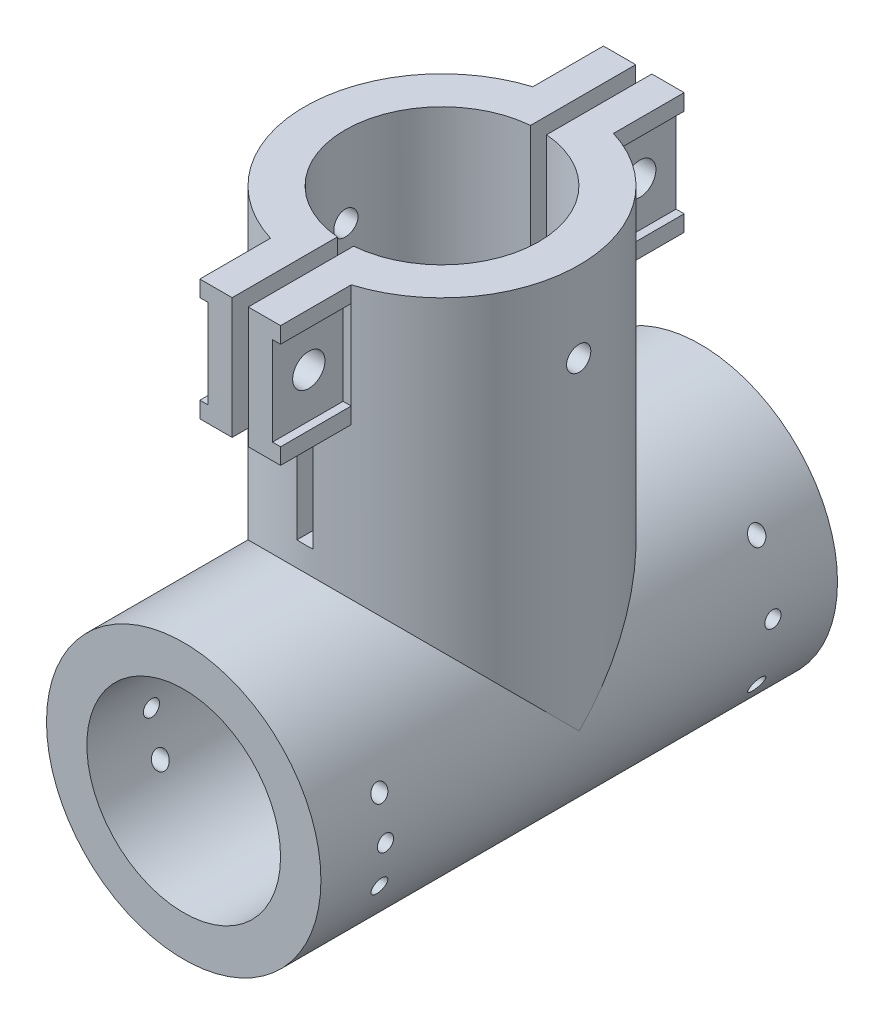
from build123d import *

# Parameters (mm, degrees)
SKETCH1_R             = 17
SKETCH1_R_2           = 12
BOSS_EXTRUDE1_DEPTH   = 64
SKETCH2_R             = 17
SKETCH2_R_2           = 12
BOSS_EXTRUDE2_DEPTH   = 50
SKETCH3_R             = 12
CUT_EXTRUDE1_DEPTH    = 98.406806537
SKETCH4_W             = 10
SKETCH4_H             = 15
BOSS_EXTRUDE3_DEPTH   = 25
SKETCH5_W             = 2
SKETCH5_H             = 30
CUT_EXTRUDE2_DEPTH    = 50
CUT_EXTRUDE3_START    = -50
SKETCH6_R             = 12
CUT_EXTRUDE3_DEPTH    = 50
SKETCH7_W             = 8.751923191
SKETCH7_H             = 11
KES_EKSTR_ZYON4_DEPTH = 1
SKETCH8_R             = 2
CUT_EXTRUDE5_DEPTH    = 87.59610122
SKETCH9_R             = 1
SKETCH9_R_2           = 1.5
CUT_EXTRUDE6_DEPTH    = 91.630484642
CUT_EXTRUDE7_DEPTH    = 1


with BuildPart() as part:
    # Sketch1 → Boss-Extrude1 (new body)
    with BuildSketch(Plane.XY):
        with Locations((-32.297070802, 4.423200443)):
            Circle(SKETCH1_R)
        with Locations((-32.297070802, 4.423200443)):
            Circle(SKETCH1_R_2, mode=Mode.SUBTRACT)
    extrude(amount=BOSS_EXTRUDE1_DEPTH)

    # Sketch2 → Boss-Extrude2 (add)
    with BuildSketch(Plane(origin=(0, 4.423200443, 0), x_dir=(1, 0, 0), z_dir=(0, 1, 0))):
        with Locations((-32.297070802, -32)):
            Circle(SKETCH2_R)
        with Locations((-32.297070802, -32)):
            Circle(SKETCH2_R_2, mode=Mode.SUBTRACT)
    extrude(amount=BOSS_EXTRUDE2_DEPTH)

    # Sketch3 → Cut-Extrude1 (cut, through all)
    with BuildSketch(Plane.XY.offset(64)):
        with Locations((-32.297070802, 4.423200443)):
            Circle(SKETCH3_R)
    extrude(amount=-CUT_EXTRUDE1_DEPTH, mode=Mode.SUBTRACT)

    # Sketch4 → Boss-Extrude3 (add, symmetric)
    with BuildSketch(Plane(origin=(0, 0, 32), x_dir=(-1, 0, 0), z_dir=(0, 0, -1))):
        with Locations((32.297070802, 46.923200443)):
            Rectangle(SKETCH4_W, SKETCH4_H)
    extrude(amount=BOSS_EXTRUDE3_DEPTH, both=True)

    # Sketch5 → Cut-Extrude2 (cut)
    with BuildSketch(Plane.XY.offset(57)):
        with Locations((-32.297070802, 39.423200443)):
            Rectangle(SKETCH5_W, SKETCH5_H)
    extrude(amount=-CUT_EXTRUDE2_DEPTH, mode=Mode.SUBTRACT)

    # Sketch6 → Cut-Extrude3 (cut)
    with BuildSketch(Plane(origin=(0, 54.423200443, 0), x_dir=(1, 0, 0), z_dir=(0, 1, 0)).offset(CUT_EXTRUDE3_START)):
        with Locations((-32.297070802, -32)):
            Circle(SKETCH6_R)
    extrude(amount=CUT_EXTRUDE3_DEPTH, mode=Mode.SUBTRACT)

    # Sketch7 → Kes-Ekstrüzyon4 (cut)
    with BuildSketch(Plane(origin=(-27.297070802, 0, 0), x_dir=(0, 0, -1), z_dir=(1, 0, 0))):
        with Locations((-52.624038404, 46.923200443)):
            Rectangle(SKETCH7_W, SKETCH7_H)
        with Locations((-11.375961596, 46.923200443)):
            Rectangle(SKETCH7_W, SKETCH7_H)
    extrude(amount=-KES_EKSTR_ZYON4_DEPTH, mode=Mode.SUBTRACT)

    # Sketch8 → Cut-Extrude5 (cut, through all)
    with BuildSketch(Plane(origin=(-28.297070802, 0, 0), x_dir=(0, 0, -1), z_dir=(1, 0, 0))):
        with Locations((-52.5, 46.923200443)):
            Circle(SKETCH8_R)
        with Locations((-11.5, 46.923200443)):
            Circle(SKETCH8_R)
    extrude(amount=-CUT_EXTRUDE5_DEPTH, mode=Mode.SUBTRACT)

    # Sketch9 → Cut-Extrude6 (cut, through all)
    with BuildSketch(Plane(origin=(-15.297070802, 0, 0), x_dir=(0, 0, -1), z_dir=(1, 0, 0))):
        with Locations((-56, 4.423200443)):
            Circle(SKETCH9_R)
        with Locations((-56, 9.423200443)):
            Circle(SKETCH9_R)
        with Locations((-56, -0.576799557)):
            Circle(SKETCH9_R)
        with Locations((-8, 4.423200443)):
            Circle(SKETCH9_R)
        with Locations((-8, 12.423200443)):
            Circle(SKETCH9_R)
        with Locations((-8, -3.576799557)):
            Circle(SKETCH9_R)
        with Locations((-32, 44.423200443)):
            Circle(SKETCH9_R_2)
    extrude(amount=-CUT_EXTRUDE6_DEPTH, mode=Mode.SUBTRACT)

    # Sketch10 → Cut-Extrude7 (cut)
    with BuildSketch(Plane.ZY.offset(37.297070802)):
        Polygon((15.751923191, 51.423200443), (9.751923191, 51.423200443), (9.751923191, 50.099737278), (11.5, 51.108989895), (15.125, 49.016095169), (15.125, 44.830305717), (11.5, 42.737410991), (9.751923191, 43.746663608), (9.751923191, 42.423200443), (15.751923191, 42.423200443), (15.751923191, 41.423200443), (7, 41.423200443), (7, 42.423200443), (7, 51.423200443), (7, 52.423200443), (15.751923191, 52.423200443), align=None)
        Polygon((48.248076809, 42.423200443), (48.248076809, 41.423200443), (57, 41.423200443), (57, 42.423200443), (57, 51.423200443), (57, 52.423200443), (48.248076809, 52.423200443), (48.248076809, 51.423200443), (54.248076809, 51.423200443), (54.248076809, 50.099737278), (52.5, 51.108989895), (48.875, 49.016095169), (48.875, 44.830305717), (52.5, 42.737410991), (54.248076809, 43.746663608), (54.248076809, 42.423200443), align=None)
    extrude(amount=-CUT_EXTRUDE7_DEPTH, mode=Mode.SUBTRACT)


solid = part.part
